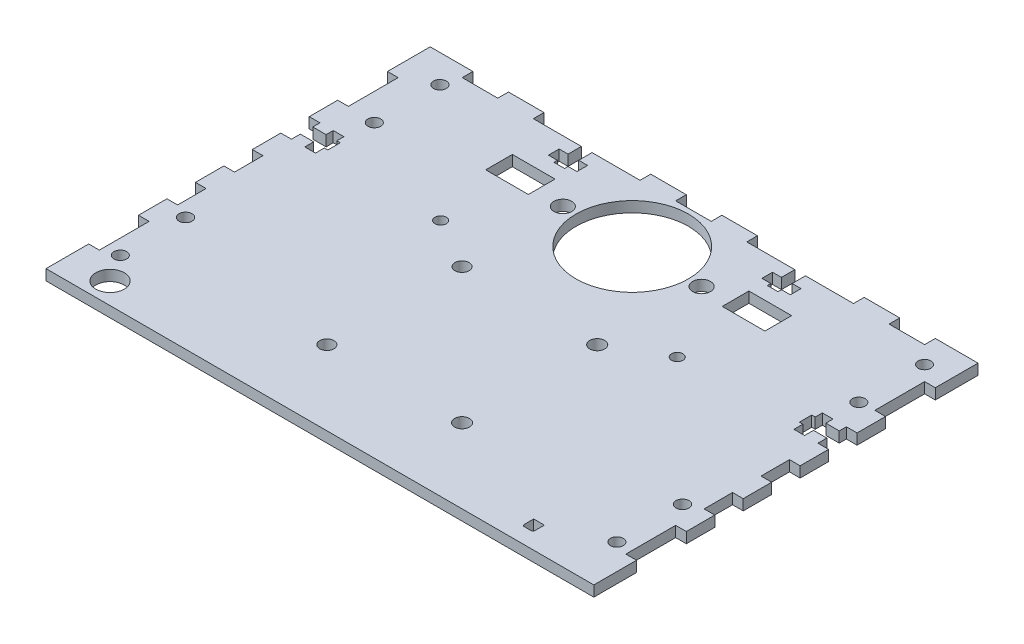
from build123d import *

# Parameters (mm, degrees)
CROQUIS1_R              = 4
SALIENTE_EXTRUIR1_DEPTH = 1.497272789
CROQUIS3_R              = 2.5
CORTAR_EXTRUIR2_DEPTH   = 3
CROQUIS4_R              = 15.8
CORTAR_EXTRUIR3_DEPTH   = 10
CROQUIS5_W              = 12
CROQUIS5_H              = 7.5
CORTAR_EXTRUIR4_DEPTH   = 10
CROQUIS6_R              = 1.600000002
CORTAR_EXTRUIR5_DEPTH   = 10
CROQUIS9_R              = 1.787352587
CROQUIS9_R_2            = 1.8
CROQUIS9_R_3            = 1.832705365
CROQUIS9_R_4            = 1.812354621
CORTAR_EXTRUIR7_DEPTH   = 10
CROQUIS10_R             = 2
CROQUIS10_R_2           = 2.1
CORTAR_EXTRUIR8_DEPTH   = 10


with BuildPart() as part:
    # Croquis1 → Saliente-Extruir1 (new, symmetric)
    with BuildSketch(Plane(origin=(0, 0, 0), x_dir=(1, 0, 0), z_dir=(0, 1, 0))):
        Polygon((-77, -42), (-77, -54), (77, -54), (77, -42), (74, -42), (74, -28), (77, -28), (77, -20), (74, -20), (74, -12), (77, -12), (77, -4), (74, -4), (74, -1.5), (74, 1.5), (74, 4), (77, 4), (77, 12), (74, 12), (74, 14.497912952), (70.25, 14.497912952), (70.25, 12), (67.25, 12), (67.25, 14.497912952), (66.27, 14.497912952), (66.27, 17.992083938), (67.25, 17.992083938), (67.25, 20), (70.25, 20), (70.25, 17.992083938), (74, 17.992083938), (74, 20), (77, 20), (77, 28), (74, 28), (74, 42), (77, 42), (77, 54), (65, 54), (65, 51), (55, 51), (55, 54), (45, 54), (45, 51), (31.5, 51), (31.5, 47.25), (34, 47.25), (34, 44.25), (31.5, 44.25), (31.5, 43.27), (28.5, 43.27), (28.5, 44.25), (26, 44.25), (26, 47.25), (28.5, 47.25), (28.5, 51), (15, 51), (15, 54), (5, 54), (5, 51), (-5, 51), (-5, 54), (-15, 54), (-15, 51), (-28.5, 51), (-28.5, 47.25), (-26, 47.25), (-26, 44.25), (-28.5, 44.25), (-28.5, 43.27), (-31.5, 43.27), (-31.5, 44.25), (-34, 44.25), (-34, 47.25), (-31.5, 47.25), (-31.5, 51), (-45, 51), (-45, 54), (-55, 54), (-55, 51), (-65, 51), (-65, 54), (-77, 54), (-77, 42), (-74, 42), (-74, 28), (-77, 28), (-77, 20), (-74, 20), (-74, 17.992083938), (-70.25, 17.992083938), (-70.25, 20), (-67.25, 20), (-67.25, 17.992083938), (-66.27, 17.992083938), (-66.27, 14.497912952), (-67.25, 14.497912952), (-67.25, 12), (-70.25, 12), (-70.25, 14.497912952), (-74, 14.497912952), (-74, 12), (-77, 12), (-77, 4), (-74, 4), (-74, 1.5), (-74, -1.5), (-74, -4), (-77, -4), (-77, -12), (-74, -12), (-74, -20), (-77, -20), (-77, -28), (-74, -28), (-74, -42), align=None)
        with Locations(Location((-65, -48, 0), (0, 0, 270))):
            Circle(CROQUIS1_R, mode=Mode.SUBTRACT)
        with BuildLine():
            Line((55, -49.6), (53, -49.6))
            ThreePointArc((53, -49.6), (52.646446609, -49.453553391), (52.5, -49.1))
            Line((52.5, -49.1), (52.5, -46.4))
            Line((52.5, -46.4), (55.5, -46.4))
            Line((55.5, -46.4), (55.5, -49.1))
            ThreePointArc((55.5, -49.1), (55.353553391, -49.453553391), (55, -49.6))
        make_face(mode=Mode.SUBTRACT)
    extrude(amount=SALIENTE_EXTRUIR1_DEPTH, both=True)

    # Croquis3 → Cortar-Extruir2 (cut)
    with BuildSketch(Plane(origin=(0, 1.497272789, 0), x_dir=(1, 0, 0), z_dir=(0, 1, 0))):
        with Locations(Location((-19.5, 33.79, 0), (0, 0, 270))):
            Circle(CROQUIS3_R)
        with Locations(Location((19.5, 33.79, 0), (0, 0, 270))):
            Circle(CROQUIS3_R)
    extrude(amount=-CORTAR_EXTRUIR2_DEPTH, mode=Mode.SUBTRACT)

    # Croquis4 → Cortar-Extruir3 (cut)
    with BuildSketch(Plane.XZ.offset(1.497272789)):
        with Locations(Location((0, -33.79, 0), (0, 0, 270))):
            Circle(CROQUIS4_R)
    extrude(amount=-CORTAR_EXTRUIR3_DEPTH, mode=Mode.SUBTRACT)

    # Croquis5 → Cortar-Extruir4 (cut)
    with BuildSketch(Plane.XZ.offset(1.497272789)):
        with Locations((-33.25, -35.6)):
            Rectangle(CROQUIS5_W, CROQUIS5_H)
        with Locations((33.25, -35.6)):
            Rectangle(CROQUIS5_W, CROQUIS5_H)
    extrude(amount=-CORTAR_EXTRUIR4_DEPTH, mode=Mode.SUBTRACT)

    # Croquis6 → Cortar-Extruir5 (cut)
    with BuildSketch(Plane(origin=(0, 1.497272789, 0), x_dir=(1, 0, 0), z_dir=(0, 1, 0))):
        with Locations(Location((33.25, 13.2, 0), (0, 0, 270))):
            Circle(CROQUIS6_R)
        with Locations(Location((-33.25, 13.2, 0), (0, 0, 270))):
            Circle(CROQUIS6_R)
    extrude(amount=-CORTAR_EXTRUIR5_DEPTH, mode=Mode.SUBTRACT)

    # Croquis9 → Cortar-Extruir7 (cut)
    with BuildSketch(Plane(origin=(0, 1.497272789, 0), x_dir=(1, 0, 0), z_dir=(0, 1, 0))):
        with Locations(Location((69.85, 46.119647413, 0), (0, 0, 270))):
            Circle(CROQUIS9_R)
        with Locations(Location((69.8, 27.693127607, 0), (0, 0, 270))):
            Circle(CROQUIS9_R_2)
        with Locations(Location((69.85, -21.925705365, 0), (0, 0, 270))):
            Circle(CROQUIS9_R_3)
        with Locations(Location((69.8, -40.306872393, 0), (0, 0, 270))):
            Circle(CROQUIS9_R_2)
        with Locations(Location((-69.8, -40.306872393, 0), (0, 0, 270))):
            Circle(CROQUIS9_R_2)
        with Locations(Location((-69.85, -21.925705365, 0), (0, 0, 270))):
            Circle(CROQUIS9_R_3)
        with Locations(Location((-66.4, 27.693127607, 0), (0, 0, 270))):
            Circle(CROQUIS9_R_2)
        with Locations(Location((-66.4, 46.119647413, 0), (0, 0, 270))):
            Circle(CROQUIS9_R_4)
    extrude(amount=-CORTAR_EXTRUIR7_DEPTH, mode=Mode.SUBTRACT)

    # Croquis10 → Cortar-Extruir8 (cut)
    with BuildSketch(Plane(origin=(0, 1.497272789, 0), x_dir=(1, 0, 0), z_dir=(0, 1, 0))):
        with Locations(Location((-19, 4.95, 0), (0, 0, 270))):
            Circle(CROQUIS10_R)
        with Locations(Location((19, 4.95, 0), (0, 0, 270))):
            Circle(CROQUIS10_R_2)
        with Locations(Location((19, -33.05, 0), (0, 0, 270))):
            Circle(CROQUIS10_R_2)
        with Locations(Location((-19, -33.05, 0), (0, 0, 270))):
            Circle(CROQUIS10_R)
    extrude(amount=-CORTAR_EXTRUIR8_DEPTH, mode=Mode.SUBTRACT)


solid = part.part
